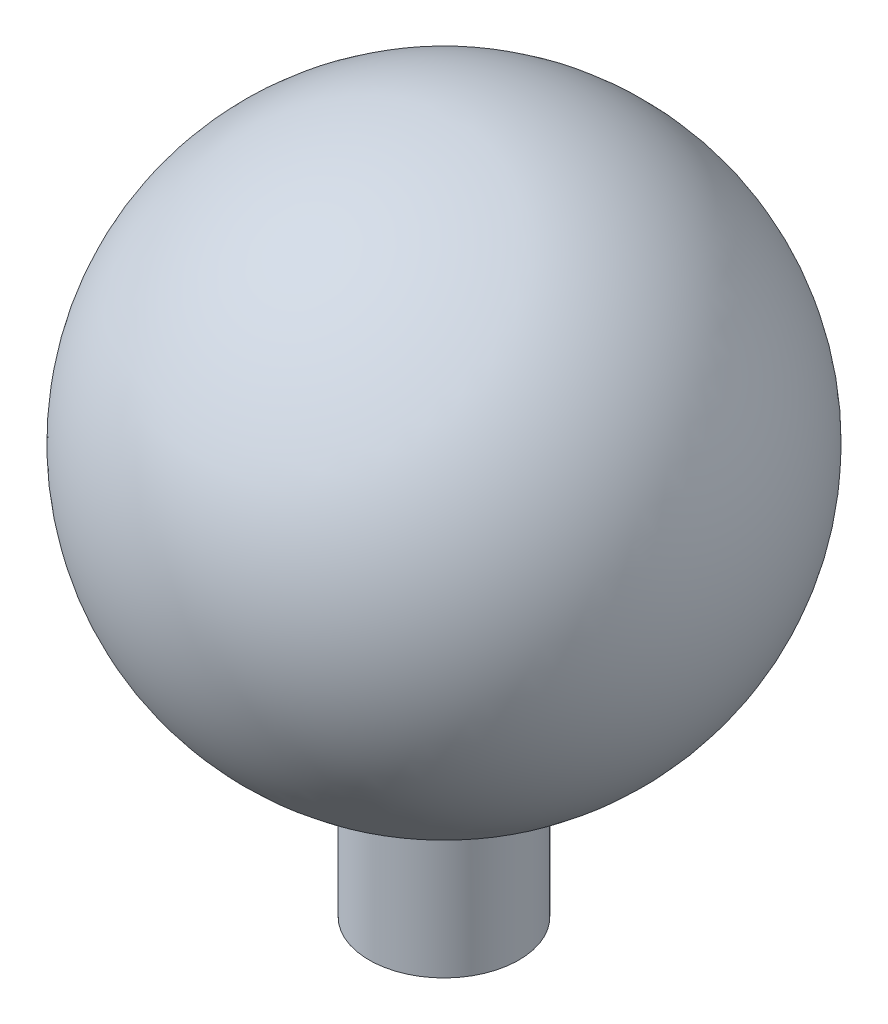
from build123d import *


with BuildPart() as part:
    # Sketch2 → Revolve1 (revolve)
    with BuildSketch(Plane.XY):
        with BuildLine():
            Line((0, 0), (0, 17.26333545))
            Line((0, 17.26333545), (0, 92.26333545))
            ThreePointArc((0, 92.26333545), (-37.158969493, 59.809223497), (-10, 18.621254713))
            Line((-10, 18.621254713), (-10, 0))
            Line((-10, 0), (0, 0))
        make_face()
    revolve(axis=Axis((0, 0, 0), (0, 1, 0)))


solid = part.part
